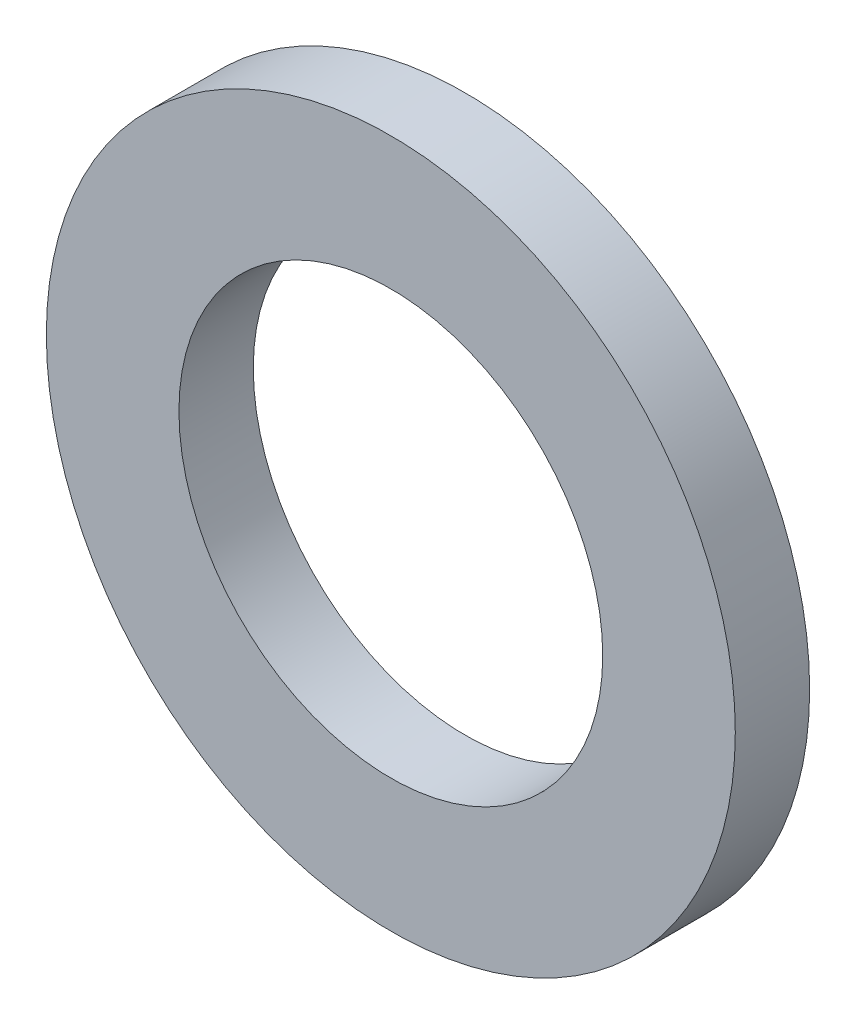
from build123d import *

# Parameters (mm, degrees)
SKETCH1_W = 3
SKETCH1_H = 5.35


with BuildPart() as part:
    # Sketch1 → Revolve1 (revolve)
    with BuildSketch(Plane(origin=(0, 0, 0), x_dir=(0, 0, -1), z_dir=(1, 0, 0)), mode=Mode.PRIVATE) as revolve1_sk:
        with Locations((0, 11.225)):
            Rectangle(SKETCH1_W, SKETCH1_H)
    revolve(revolve1_sk.sketch.rotate(Axis((0, 0, 0), (0, 0, -1)), 90), axis=Axis((0, 0, 0), (0, 0, -1)))


solid = part.part
